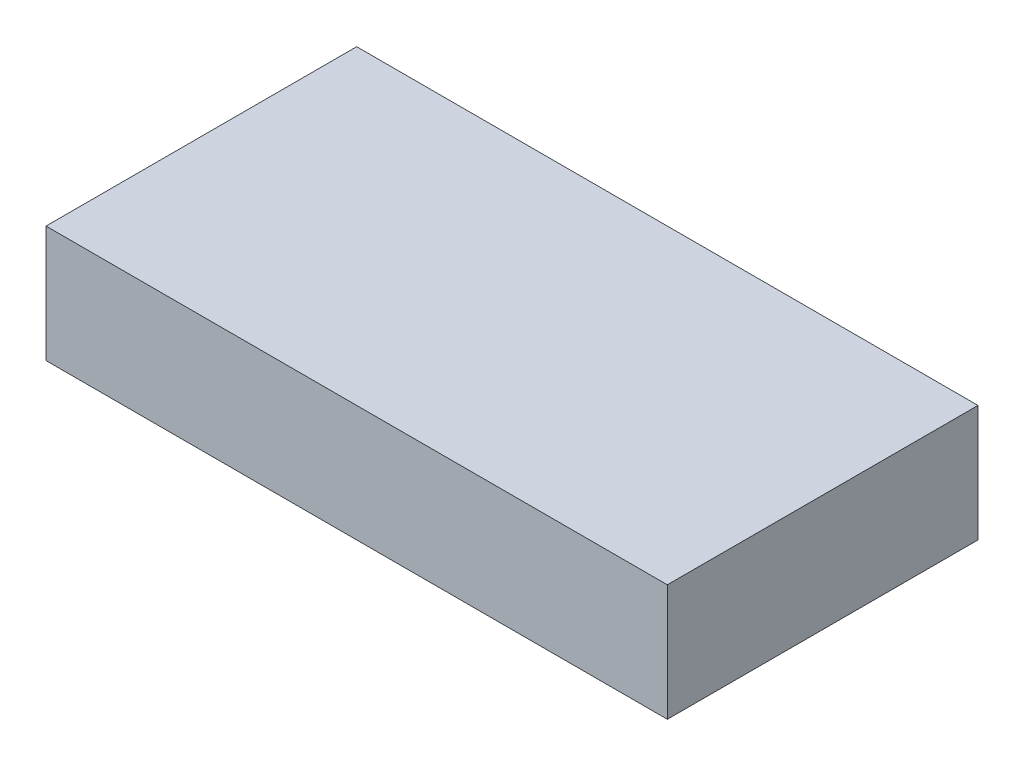
from build123d import *

# Parameters (mm, degrees)
SKETCH1_W           = 160
SKETCH1_H           = 30
BOSS_EXTRUDE1_DEPTH = 80
SHELL1_T            = -5
SKETCH2_R           = 4.17592015
CUT_EXTRUDE1_DEPTH  = 15
LPATTERN1_COUNT     = 4
LPATTERN1_PITCH     = 110


with BuildPart() as part:
    # Sketch1 → Boss-Extrude1 (new body)
    with BuildSketch(Plane.XY):
        with Locations((34.869684499, 8.141289438)):
            Rectangle(SKETCH1_W, SKETCH1_H)
    extrude(amount=BOSS_EXTRUDE1_DEPTH)

    # Shell1
    shell1_openings = [part.faces().sort_by_distance(p)[0] for p in [
        (34.869684499, -6.858710562, 40),
    ]]
    offset(amount=SHELL1_T, openings=shell1_openings, kind=Kind.INTERSECTION)

    # Sketch2 → Cut-Extrude1 (cut)
    with BuildSketch(Plane(origin=(0, 0, 0), x_dir=(-1, 0, 0), z_dir=(0, 0, -1))):
        with Locations((30.130315501, 7.814471991)):
            Circle(SKETCH2_R)
    cut_extrude1 = extrude(amount=-CUT_EXTRUDE1_DEPTH, mode=Mode.SUBTRACT)

    # LPattern1: Cut-Extrude1 ×4
    with Locations(*[(i * LPATTERN1_PITCH, 0, 0) for i in range(1, LPATTERN1_COUNT)]):
        add(cut_extrude1, mode=Mode.SUBTRACT)


solid = part.part
